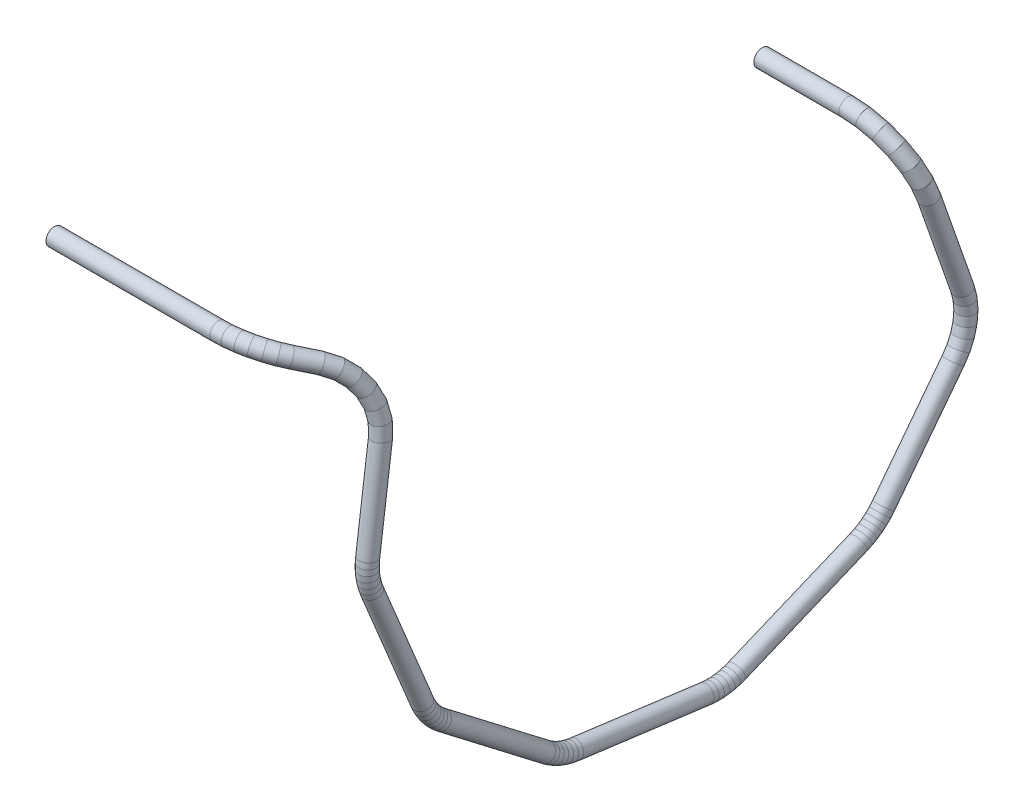
from build123d import *

# Parameters (mm, degrees)
PROFILE_R   = 2.5
PROFILE_R_2 = 1


with BuildPart() as part:
    # Tube: sweep along a curve in space
    with BuildLine() as tube_path:
        Line((-571, 44.888766616, 108.371069164), (-523.067063489, 44.888766616, 108.371069164))
        Line((-523.067063489, 44.888766616, 108.371069164), (-520.278596322, 44.805609846, 108.170310961))
        Line((-520.278596322, 44.805609846, 108.170310961), (-517.55745487, 44.558147302, 107.57288353))
        Line((-517.55745487, 44.558147302, 107.57288353), (-514.969339315, 44.152353804, 106.593211363))
        Line((-514.969339315, 44.152353804, 106.593211363), (-512.576738012, 43.598026971, 105.254948006))
        Line((-512.576738012, 43.598026971, 105.254948006), (-510.437418755, 42.908550662, 103.59040495))
        Line((-510.437418755, 42.908550662, 103.59040495), (-508.603034008, 42.100571832, 101.6397715))
        Line((-508.603034008, 42.100571832, 101.6397715), (-504.675521506, 40.071529979, 96.741231141))
        Line((-504.675521506, 40.071529979, 96.741231141), (-502.323870163, 38.389041622, 93.869720735))
        Line((-502.323870163, 38.389041622, 93.869720735), (-500.209515795, 35.917967542, 91.414134937))
        Line((-500.209515795, 35.917967542, 91.414134937), (-498.440829525, 32.784962511, 89.500334669))
        Line((-498.440829525, 32.784962511, 89.500334669), (-497.108465275, 29.150608538, 88.226411663))
        Line((-497.108465275, 29.150608538, 88.226411663), (-496.280713305, 25.201184248, 87.657660777))
        Line((-496.280713305, 25.201184248, 87.657660777), (-496, 21.139117177, 87.823233308))
        Line((-496, 21.139117177, 87.823233308), (-496, -7.357112577, 91.574833127))
        Line((-496, -7.357112577, 91.574833127), (-496, -8.921435065, 91.711693611))
        Line((-496, -8.921435065, 91.711693611), (-496, -10.49173301, 91.711693611))
        Line((-496, -10.49173301, 91.711693611), (-496, -12.056055497, 91.574833127))
        Line((-496, -12.056055497, 91.574833127), (-496, -13.602497088, 91.302153751))
        Line((-496, -13.602497088, 91.302153751), (-496, -15.119288428, 90.895730736))
        Line((-496, -15.119288428, 90.895730736), (-496, -16.59488582, 90.358657208))
        Line((-496, -16.59488582, 90.358657208), (-496, -52.158862954, 75.627575547))
        Line((-496, -52.158862954, 75.627575547), (-496, -53.58203621, 74.963938959))
        Line((-496, -53.58203621, 74.963938959), (-496, -54.941954122, 74.178789986))
        Line((-496, -54.941954122, 74.178789986), (-496, -56.228266894, 73.278104087))
        Line((-496, -56.228266894, 73.278104087), (-496, -57.431184909, 72.268736024))
        Line((-496, -57.431184909, 72.268736024), (-496, -58.541553234, 71.158367699))
        Line((-496, -58.541553234, 71.158367699), (-496, -59.550921297, 69.955449684))
        Line((-496, -59.550921297, 69.955449684), (-496, -82.984688124, 39.415970173))
        Line((-496, -82.984688124, 39.415970173), (-496, -83.885374024, 38.129657401))
        Line((-496, -83.885374024, 38.129657401), (-496, -84.670522996, 36.769739489))
        Line((-496, -84.670522996, 36.769739489), (-496, -85.334159584, 35.346566234))
        Line((-496, -85.334159584, 35.346566234), (-496, -85.871233113, 33.870968842))
        Line((-496, -85.871233113, 33.870968842), (-496, -86.277656127, 32.354177502))
        Line((-496, -86.277656127, 32.354177502), (-496, -86.550335504, 30.807735911))
        Line((-496, -86.550335504, 30.807735911), (-496, -91.574833127, -7.357112577))
        Line((-496, -91.574833127, -7.357112577), (-496, -91.711693611, -8.921435065))
        Line((-496, -91.711693611, -8.921435065), (-496, -91.711693611, -10.49173301))
        Line((-496, -91.711693611, -10.49173301), (-496, -91.574833127, -12.056055497))
        Line((-496, -91.574833127, -12.056055497), (-496, -91.302153751, -13.602497088))
        Line((-496, -91.302153751, -13.602497088), (-496, -90.895730736, -15.119288428))
        Line((-496, -90.895730736, -15.119288428), (-496, -90.358657208, -16.59488582))
        Line((-496, -90.358657208, -16.59488582), (-496, -75.627575547, -52.158862954))
        Line((-496, -75.627575547, -52.158862954), (-496, -74.963938959, -53.58203621))
        Line((-496, -74.963938959, -53.58203621), (-496, -74.178789986, -54.941954122))
        Line((-496, -74.178789986, -54.941954122), (-496, -73.278104087, -56.228266894))
        Line((-496, -73.278104087, -56.228266894), (-496, -72.268736024, -57.431184909))
        Line((-496, -72.268736024, -57.431184909), (-496, -71.158367699, -58.541553234))
        Line((-496, -71.158367699, -58.541553234), (-496, -69.955449684, -59.550921297))
        Line((-496, -69.955449684, -59.550921297), (-496, -43.312263039, -79.994957456))
        Line((-496, -43.312263039, -79.994957456), (-496, -40.81390515, -81.602940045))
        Line((-496, -40.81390515, -81.602940045), (-496, -38.085071804, -82.77804375))
        Line((-496, -38.085071804, -82.77804375), (-496, -35.200110235, -83.488252795))
        Line((-496, -35.200110235, -83.488252795), (-496, -32.237621399, -83.714217493))
        Line((-496, -32.237621399, -83.714217493), (-496, -29.27831849, -83.44978142))
        Line((-496, -29.27831849, -83.44978142), (-496, -26.402827898, -82.702149153))
        Line((-496, -26.402827898, -82.702149153), (-496, 1.712448177, -72.851729418))
        Line((-496, 1.712448177, -72.851729418), (-496.613335127, 6.109150119, -71.311308494))
        Line((-496.613335127, 6.109150119, -71.311308494), (-498.411542732, 10.206224089, -69.875864709))
        Line((-498.411542732, 10.206224089, -69.875864709), (-501.272077939, 13.724461267, -68.643221187))
        Line((-501.272077939, 13.724461267, -68.643221187), (-505, 16.424099604, -67.697380546))
        Line((-505, 16.424099604, -67.697380546), (-509.341257188, 18.121163208, -67.102800262))
        Line((-509.341257188, 18.121163208, -67.102800262), (-514, 18.7, -66.9))
        Line((-514, 18.7, -66.9), (-538.85, 18.7, -66.9))
    # Profile → Tube (sweep)
    with BuildSketch(Plane(origin=(-571, 0, 0), x_dir=(0, 0, -1), z_dir=(1, 0, 0))):
        with Locations((-108.371069164, 44.888766616)):
            Circle(PROFILE_R)
        with Locations((-108.371069164, 44.888766616)):
            Circle(PROFILE_R_2, mode=Mode.SUBTRACT)
    sweep(path=tube_path.line, transition=Transition.RIGHT)


solid = part.part
